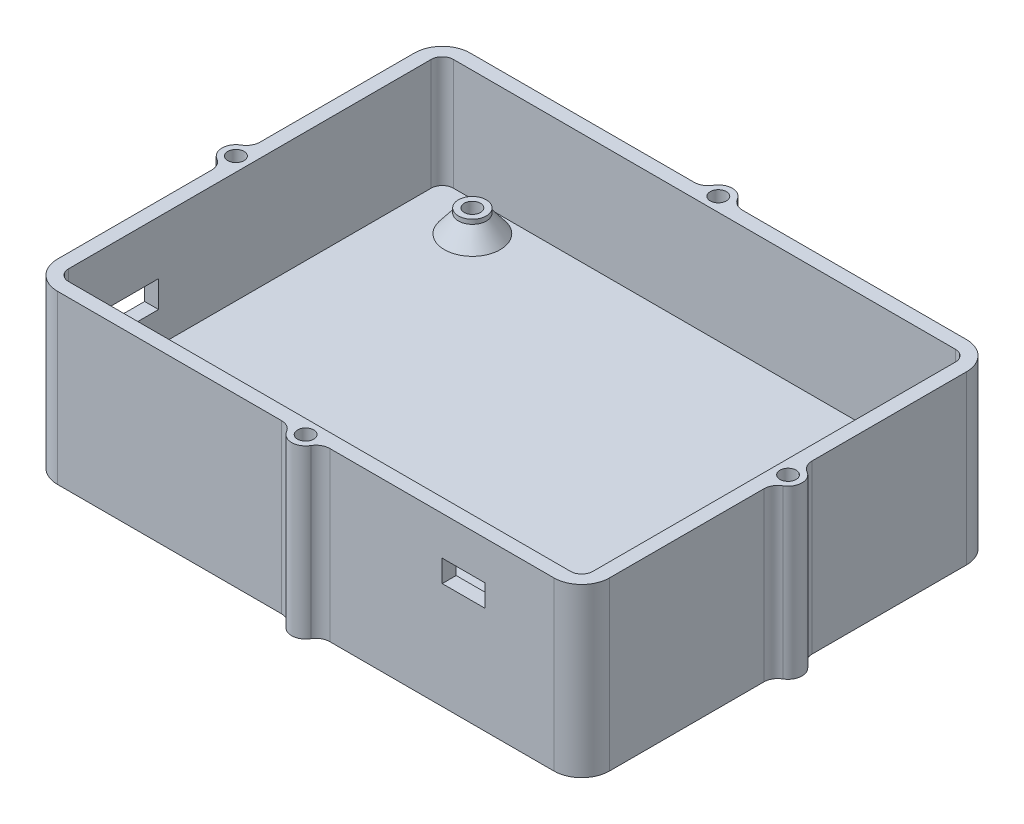
from build123d import *

# Parameters (mm, degrees)
SKETCH1_W           = 99
SKETCH1_H           = 74
BOSS_EXTRUDE1_DEPTH = 30
SKETCH2_W           = 94
SKETCH2_H           = 69
CUT_EXTRUDE1_DEPTH  = 20
FILLET2_R           = 5
FILLET3_R           = 2
SKETCH3_R           = 2.5
BOSS_EXTRUDE2_DEPTH = 4
SKETCH8_R           = 1.45
CUT_EXTRUDE4_DEPTH  = 5
CHAMFER1_SIZE       = 2.5
CHAMFER1_SIZE2      = 3.19985408
CHAMFER2_SIZE       = 2.5
CHAMFER2_SIZE2      = 3.19985408
CHAMFER3_SIZE       = 2.5
CHAMFER3_SIZE2      = 3.19985408
CHAMFER4_SIZE       = 2.5
CHAMFER4_SIZE2      = 3.19985408
BOSS_EXTRUDE3_DEPTH = 30
SKETCH11_R          = 1.45
CUT_EXTRUDE5_DEPTH  = 6
FILLET5_R           = 2.5
SKETCH13_W          = 10
SKETCH13_H          = 4.8
CUT_EXTRUDE7_DEPTH  = 2.5
SKETCH14_W          = 7.6999997
SKETCH14_H          = 3.94999985
CUT_EXTRUDE8_DEPTH  = 2.5


with BuildPart() as part:
    # Sketch1 → Boss-Extrude1 (new body)
    with BuildSketch(Plane(origin=(0, 0, 0), x_dir=(1, 0, 0), z_dir=(0, 1, 0))):
        Rectangle(SKETCH1_W, SKETCH1_H)
    extrude(amount=BOSS_EXTRUDE1_DEPTH)

    # Sketch2 → Cut-Extrude1 (cut)
    with BuildSketch(Plane(origin=(0, 30, 0), x_dir=(1, 0, 0), z_dir=(0, 1, 0))):
        Rectangle(SKETCH2_W, SKETCH2_H)
    extrude(amount=-CUT_EXTRUDE1_DEPTH, mode=Mode.SUBTRACT)

    # Fillet2
    fillet2_edges = [part.edges().sort_by_distance(p)[0] for p in [
        (49.5, 15, 37),
        (-49.5, 15, 37),
        (-49.5, 15, -37),
        (49.5, 15, -37),
    ]]
    fillet(fillet2_edges, radius=FILLET2_R)

    # Fillet3
    fillet3_edges = [part.edges().sort_by_distance(p)[0] for p in [
        (47, 20, -34.5),
        (47, 20, 34.5),
        (-47, 20, 34.5),
        (-47, 20, -34.5),
    ]]
    fillet(fillet3_edges, radius=FILLET3_R)

    # Sketch3 → Boss-Extrude2 (add)
    with BuildSketch(Plane(origin=(0, 10, 0), x_dir=(1, 0, 0), z_dir=(0, 1, 0))):
        with Locations(Location((-36.255, 29.1465, 0), (0, 0, 270))):
            Circle(SKETCH3_R)
        with Locations(Location((41.469, 29.1465, 0), (0, 0, 270))):
            Circle(SKETCH3_R)
        with Locations(Location((41.471, -28.8925, 0), (0, 0, 270))):
            Circle(SKETCH3_R)
        with Locations(Location((-36.763, -28.8925, 0), (0, 0, 270))):
            Circle(SKETCH3_R)
    extrude(amount=BOSS_EXTRUDE2_DEPTH)

    # Sketch8 → Cut-Extrude4 (cut)
    with BuildSketch(Plane(origin=(0, 14, 0), x_dir=(1, 0, 0), z_dir=(0, 1, 0))):
        with Locations(Location((-36.255, 29.1465, 0), (0, 0, 270))):
            Circle(SKETCH8_R)
        with Locations(Location((-36.763, -28.8925, 0), (0, 0, 270))):
            Circle(SKETCH8_R)
        with Locations(Location((41.469, 29.1465, 0), (0, 0, 270))):
            Circle(SKETCH8_R)
        with Locations(Location((41.471, -28.8925, 0), (0, 0, 270))):
            Circle(SKETCH8_R)
    extrude(amount=-CUT_EXTRUDE4_DEPTH, mode=Mode.SUBTRACT)

    # Chamfer1
    chamfer1_edges = [part.edges().sort_by_distance(p)[0] for p in [
        (-36.763, 10, 26.3925),
    ]]
    chamfer1_side = [part.faces().sort_by_distance(p)[0] for p in [
        (-0.030421175, 10, 0.001557545),
    ]]
    chamfer(chamfer1_edges, length=CHAMFER1_SIZE, length2=CHAMFER1_SIZE2, reference=chamfer1_side[0])

    # Chamfer2
    chamfer2_edges = [part.edges().sort_by_distance(p)[0] for p in [
        (41.471, 10, 26.3925),
    ]]
    chamfer2_side = [part.faces().sort_by_distance(p)[0] for p in [
        (0.310585286, 10, -0.266651178),
    ]]
    chamfer(chamfer2_edges, length=CHAMFER2_SIZE, length2=CHAMFER2_SIZE2, reference=chamfer2_side[0])

    # Chamfer3
    chamfer3_edges = [part.edges().sort_by_distance(p)[0] for p in [
        (-36.255, 10, -31.6465),
    ]]
    chamfer3_side = [part.faces().sort_by_distance(p)[0] for p in [
        (-0.075107512, 10, -0.53988639),
    ]]
    chamfer(chamfer3_edges, length=CHAMFER3_SIZE, length2=CHAMFER3_SIZE2, reference=chamfer3_side[0])

    # Chamfer4
    chamfer4_edges = [part.edges().sort_by_distance(p)[0] for p in [
        (41.469, 10, -31.6465),
    ]]
    chamfer4_side = [part.faces().sort_by_distance(p)[0] for p in [
        (0.267122265, 10, -0.269293132),
    ]]
    chamfer(chamfer4_edges, length=CHAMFER4_SIZE, length2=CHAMFER4_SIZE2, reference=chamfer4_side[0])

    # Sketch10 → Boss-Extrude3 (add)
    with BuildSketch(Plane.XZ):
        with BuildLine():
            Line((-2.5, 37), (2.5, 37))
            ThreePointArc((2.5, 37), (0, 39.5), (-2.5, 37))
        make_face()
        with BuildLine():
            Line((-49.5, -2.5), (-49.5, 2.5))
            ThreePointArc((-49.5, 2.5), (-52, 0), (-49.5, -2.5))
        make_face()
        with BuildLine():
            Line((-2.5, -37), (2.5, -37))
            ThreePointArc((2.5, -37), (0, -39.5), (-2.5, -37))
        make_face()
        with BuildLine():
            Line((49.5, 2.5), (49.5, -2.5))
            ThreePointArc((49.5, -2.5), (52, 0), (49.5, 2.5))
        make_face()
    extrude(amount=-BOSS_EXTRUDE3_DEPTH)

    # Sketch11 → Cut-Extrude5 (cut)
    with BuildSketch(Plane(origin=(0, 30, 0), x_dir=(1, 0, 0), z_dir=(0, 1, 0))):
        with Locations(Location((0, 37, 0), (0, 0, 270))):
            Circle(SKETCH11_R)
        with Locations(Location((-49.5, 0, 0), (0, 0, 270))):
            Circle(SKETCH11_R)
        with Locations(Location((0, -37, 0), (0, 0, 270))):
            Circle(SKETCH11_R)
        with Locations(Location((49.5, 0, 0), (0, 0, 270))):
            Circle(SKETCH11_R)
    extrude(amount=-CUT_EXTRUDE5_DEPTH, mode=Mode.SUBTRACT)

    # Fillet5
    fillet5_edges = [part.edges().sort_by_distance(p)[0] for p in [
        (2.5, 15, 37),
        (-2.5, 15, 37),
        (-2.5, 15, -37),
        (2.5, 15, -37),
        (-49.5, 15, 2.5),
        (-49.5, 15, -2.5),
        (49.5, 15, -2.5),
        (49.5, 15, 2.5),
    ]]
    fillet(fillet5_edges, radius=FILLET5_R)

    # Sketch13 → Cut-Extrude7 (cut)
    with BuildSketch(Plane.ZY.offset(49.5)):
        with Locations((21.37405504, 18)):
            Rectangle(SKETCH13_W, SKETCH13_H)
    extrude(amount=-CUT_EXTRUDE7_DEPTH, mode=Mode.SUBTRACT)

    # Sketch14 → Cut-Extrude8 (cut)
    with BuildSketch(Plane.XY.offset(37)):
        with Locations((28.33814532, 21.075027895)):
            Rectangle(SKETCH14_W, SKETCH14_H)
    extrude(amount=-CUT_EXTRUDE8_DEPTH, mode=Mode.SUBTRACT)


solid = part.part
